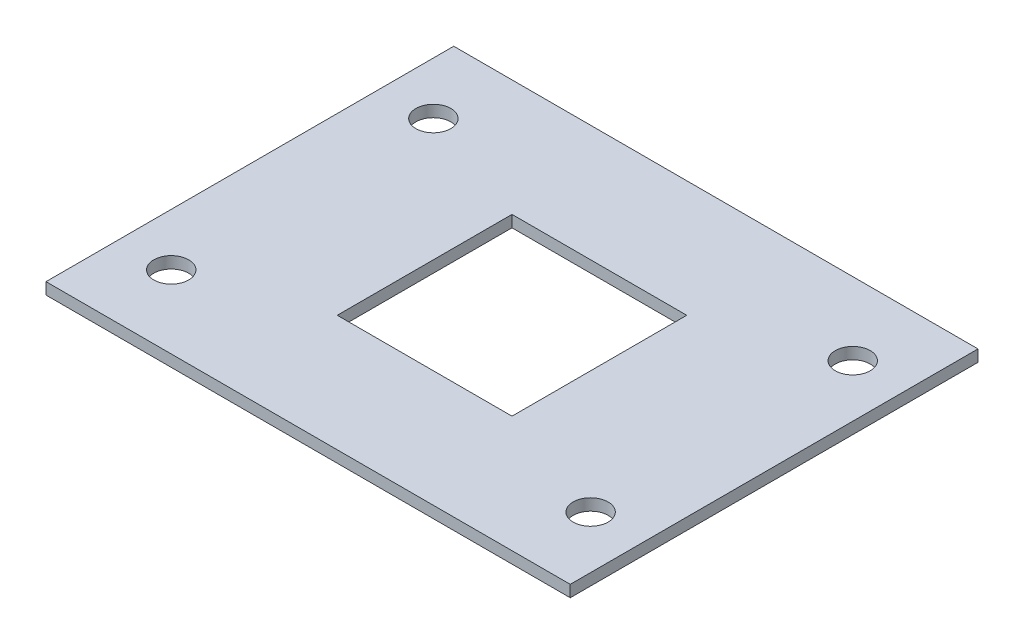
from build123d import *

# Parameters (mm, degrees)
CROQUIS1_R              = 1.5
CROQUIS1_W              = 15
CROQUIS1_H              = 15
SALIENTE_EXTRUIR1_DEPTH = 1
CROQUIS2_W              = 45
CROQUIS2_H              = 5
CORTAR_EXTRUIR1_DEPTH   = 10


with BuildPart() as part:
    # Croquis1 → Saliente-Extruir1 (new body)
    with BuildSketch(Plane(origin=(0, 0, 0), x_dir=(1, 0, 0), z_dir=(0, 1, 0))):
        with BuildLine():
            ThreePointArc((-15, -14.898453182), (-14.949747468, -14.949747468), (-14.898453182, -15))
            Line((-14.898453182, -15), (30, -15))
            Line((30, -15), (30, 30))
            Line((30, 30), (-15, 30))
            Line((-15, 30), (-15, -14.898453182))
        make_face()
        with Locations(Location((-10.5, -3.75, 0), (0, 0, 270))):
            Circle(CROQUIS1_R, mode=Mode.SUBTRACT)
        with Locations(Location((25.5, -3.75, 0), (0, 0, 270))):
            Circle(CROQUIS1_R, mode=Mode.SUBTRACT)
        with Locations(Location((-10.5, 18.75, 0), (0, 0, 270))):
            Circle(CROQUIS1_R, mode=Mode.SUBTRACT)
        with Locations((7.5, 7.5)):
            Rectangle(CROQUIS1_W, CROQUIS1_H, mode=Mode.SUBTRACT)
        with Locations(Location((25.5, 18.75, 0), (0, 0, 270))):
            Circle(CROQUIS1_R, mode=Mode.SUBTRACT)
    extrude(amount=SALIENTE_EXTRUIR1_DEPTH)

    # Croquis2 → Cortar-Extruir1 (cut)
    with BuildSketch(Plane(origin=(0, 1, 0), x_dir=(1, 0, 0), z_dir=(0, 1, 0))):
        with Locations((7.5, -12.5)):
            Rectangle(CROQUIS2_W, CROQUIS2_H)
        with Locations((7.5, 27.5)):
            Rectangle(CROQUIS2_W, CROQUIS2_H)
    extrude(amount=-CORTAR_EXTRUIR1_DEPTH, mode=Mode.SUBTRACT)


solid = part.part
